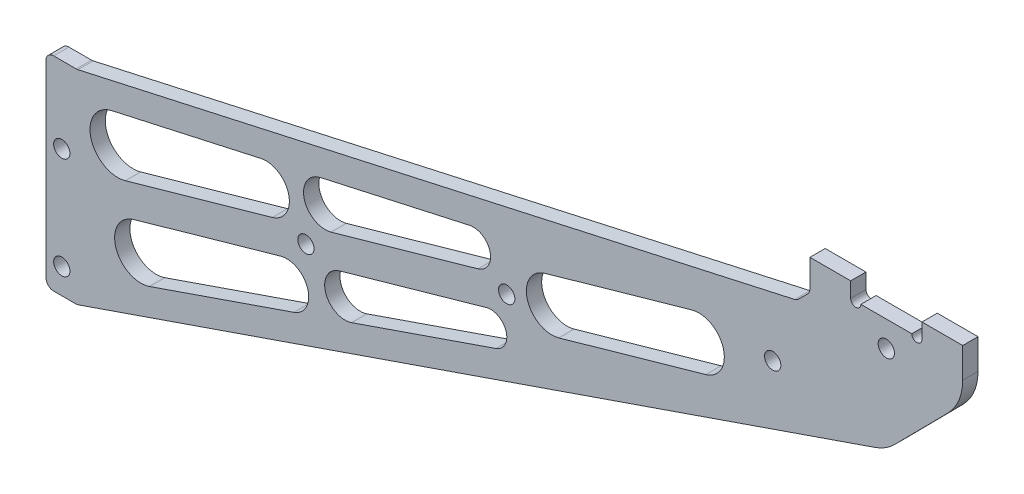
from build123d import *
from OCP.BRepFilletAPI import BRepFilletAPI_MakeChamfer

# Parameters (mm, degrees)
SKETCH_1_R          = 1.6
EXTRUDE_1_DEPTH     = 3
SKETCH_2_R          = 1.6
CUT_EXTRUDE_1_DEPTH = 3
CHAMFER_1_SIZE      = 2
CHAMFER_1_SIZE2     = 3.230198514
CHAMFER_1_SIZE2_2   = 2.634764865
SKETCH_3_R          = 1.6
CUT_EXTRUDE_2_DEPTH = 3
CUT_EXTRUDE_3_DEPTH = 3
FILLET_1_R          = 10
FILLET_2_R          = 1.5


with BuildPart() as part:
    # 草图1 → 凸台-拉伸1 (new body)
    with BuildSketch(Plane.XY):
        with BuildLine():
            Line((150, 32), (6.1, 0))
            Line((6.1, 0), (0, 0))
            Line((0, 0), (0, -40))
            Line((0, -40), (6.1, -40))
            Line((6.1, -40), (180, 20))
            Line((180, 20), (180, 40))
            Line((180, 40), (172, 40))
            Line((172, 40), (172, 37))
            ThreePointArc((172, 37), (171, 36), (170, 37))
            Line((170, 37), (160, 37))
            ThreePointArc((160, 37), (159, 36), (158, 37))
            Line((158, 37), (158, 40))
            Line((158, 40), (150, 40))
            Line((150, 40), (150, 32))
        make_face()
        with Locations((3.1, -35)):
            Circle(SKETCH_1_R, mode=Mode.SUBTRACT)
        with Locations((3.1, -15)):
            Circle(SKETCH_1_R, mode=Mode.SUBTRACT)
    extrude(amount=EXTRUDE_1_DEPTH)

    # 草图2 → 切除-拉伸1 (cut)
    with BuildSketch(Plane.XY.offset(3)):
        with Locations((165, 32)):
            Circle(SKETCH_2_R)
    extrude(amount=-CUT_EXTRUDE_1_DEPTH, mode=Mode.SUBTRACT)

    # 倒角1: one chamfer whose edges measure the first distance from different faces: ONE call of the kernel's chamfer builder (chamfer() names one face for all edges)
    chamfer_1_edges_1 = [part.edges().sort_by_distance(p)[0] for p in [
        (180, 20, 1.5),
    ]]
    chamfer_1_side_1 = [part.faces().sort_by_distance(p)[0] for p in [
        (93.05, -10, 1.5),
    ]]
    chamfer_1_edges_2 = [part.edges().sort_by_distance(p)[0] for p in [
        (150, 32, 1.5),
    ]]
    chamfer_1_side_2 = [part.faces().sort_by_distance(p)[0] for p in [
        (150, 36, 1.5),
    ]]
    chamfer_1 = BRepFilletAPI_MakeChamfer(part.part.solid().wrapped)
    for e in chamfer_1_edges_1:
        chamfer_1.Add(CHAMFER_1_SIZE, CHAMFER_1_SIZE2, e.wrapped, chamfer_1_side_1[0].wrapped)  # the first distance lies on this face
    for e in chamfer_1_edges_2:
        chamfer_1.Add(CHAMFER_1_SIZE, CHAMFER_1_SIZE2_2, e.wrapped, chamfer_1_side_2[0].wrapped)  # the first distance lies on this face
    add(Compound.cast(chamfer_1.Shape()), mode=Mode.REPLACE)

    # 草图3 → 切除-拉伸2 (cut)
    with BuildSketch(Plane.XY.offset(3)):
        with Locations((51.030979005, -7.253024477)):
            Circle(SKETCH_3_R)
        with Locations((90.458641741, 3.932653266)):
            Circle(SKETCH_3_R)
        with Locations((142.688604417, 18.75035968)):
            Circle(SKETCH_3_R)
        with BuildLine():
            Line((20.319493435, -29.80466571), (48.667912828, -20.023727449))
            ThreePointArc((48.667912828, -20.023727449), (51.382781252, -14.640684155), (46.077566644, -11.776707266))
            Line((46.077566644, -11.776707266), (17.22778338, -19.961427236))
            ThreePointArc((17.22778338, -19.961427236), (13.712756492, -26.472643184), (20.319493435, -29.80466571))
        make_face()
        with BuildLine():
            Line((97.96293832, 11.258954093), (126.823953345, 19.446860527))
            ThreePointArc((126.823953345, 19.446860527), (132.998773588, 16.001342428), (129.553255489, 9.826522185))
            Line((129.553255489, 9.826522185), (100.692240465, 1.638615751))
            ThreePointArc((100.692240465, 1.638615751), (94.517420222, 5.08413385), (97.96293832, 11.258954093))
        make_face()
        with BuildLine():
            Line((60.007280586, -16.111352144), (88.355699979, -6.330413883))
            ThreePointArc((88.355699979, -6.330413883), (90.334917033, -2.406020717), (86.467263213, -0.318099309))
            Line((86.467263213, -0.318099309), (57.617479949, -8.502819279))
            ThreePointArc((57.617479949, -8.502819279), (54.900467894, -13.53579706), (60.007280586, -16.111352144))
        make_face()
        with BuildLine():
            Line((15.590202093, -14.189224231), (44.439985357, -6.004504261))
            ThreePointArc((44.439985357, -6.004504261), (47.641256823, -0.456756962), (42.188030072, 2.902998549))
            Line((42.188030072, 2.902998549), (12.91477289, -3.60669033))
            ThreePointArc((12.91477289, -3.60669033), (8.806536259, -10.274778475), (15.590202093, -14.189224231))
        make_face()
        with BuildLine():
            Line((55.979898663, -2.730616274), (84.829681926, 5.454103696))
            ThreePointArc((84.829681926, 5.454103696), (87.188167139, 9.5413172), (83.170590126, 12.016562981))
            Line((83.170590126, 12.016562981), (53.897332945, 5.506874101))
            ThreePointArc((53.897332945, 5.506874101), (50.699463699, 0.316405313), (55.979898663, -2.730616274))
        make_face()
    extrude(amount=-CUT_EXTRUDE_2_DEPTH, mode=Mode.SUBTRACT)

    # 草图4 → 切除-拉伸3 (cut)
    with BuildSketch(Plane.XY.offset(3)):
        Polygon((180, 30), (165, 14.824611846), (178.109369602, 19.347683589), (180, 23.230198514), align=None)
    extrude(amount=-CUT_EXTRUDE_3_DEPTH, mode=Mode.SUBTRACT)

    # 圆角1
    fillet_1_edges = [part.edges().sort_by_distance(p)[0] for p in [
        (180, 30, 1.5),
        (165, 14.824611846, 1.5),
    ]]
    fillet(fillet_1_edges, radius=FILLET_1_R)

    # 圆角2
    fillet_2_edges = [part.edges().sort_by_distance(p)[0] for p in [
        (6.1, -40, 1.5),
        (0, -40, 1.5),
        (0, 0, 1.5),
        (6.1, 0, 1.5),
        (147.428060769, 31.428060769, 1.5),
        (150, 34, 1.5),
    ]]
    fillet(fillet_2_edges, radius=FILLET_2_R)


solid = part.part
